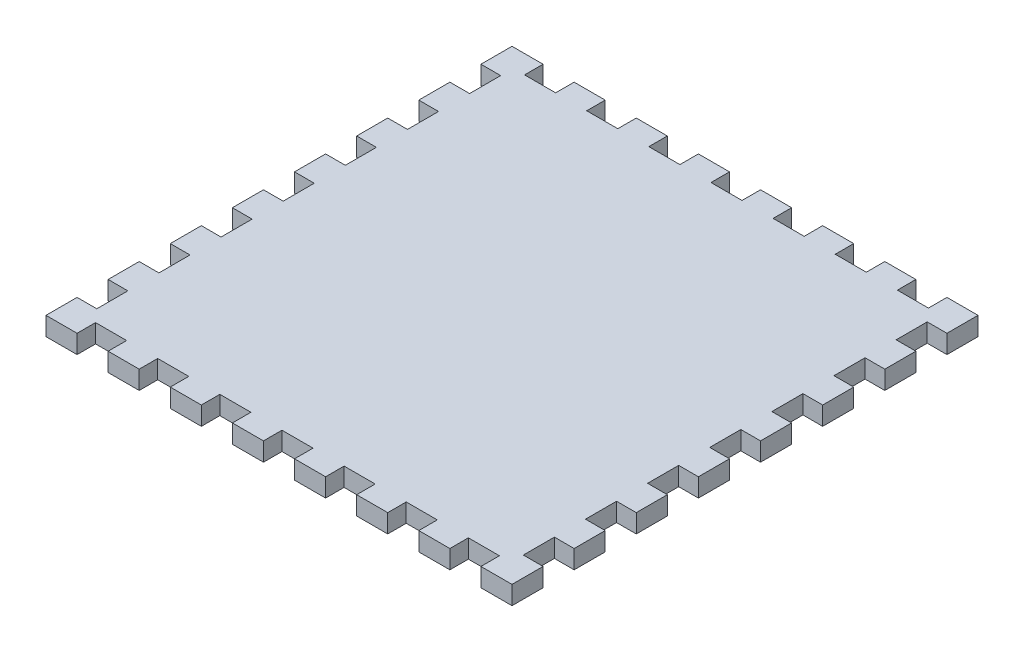
from build123d import *

# Parameters (mm, degrees)
SKETCH1_W           = 80
SKETCH1_H           = 80
BOSS_EXTRUDE1_DEPTH = 3.175
SKETCH3_OUTSIDE_W   = 104.636
SKETCH3_OUTSIDE_H   = 104.636
CUT_EXTRUDE1_DEPTH  = 57.657573413


with BuildPart() as part:
    # Sketch1 → Boss-Extrude1 (new body)
    with BuildSketch(Plane(origin=(0, 0, 0), x_dir=(1, 0, 0), z_dir=(0, 1, 0))):
        Rectangle(SKETCH1_W, SKETCH1_H)
    extrude(amount=BOSS_EXTRUDE1_DEPTH)

    # Sketch3 outside → Cut-Extrude1 (cut, through all)
    with BuildSketch(Plane(origin=(0, 3.175, 0), x_dir=(1, 0, 0), z_dir=(0, 1, 0))):
        Rectangle(SKETCH3_OUTSIDE_W, SKETCH3_OUTSIDE_H)
        Polygon((-40, -40), (-34.666666667, -40), (-34.666666667, -36.825), (-29.333333333, -36.825), (-29.333333333, -40), (-24, -40), (-24, -36.825), (-18.666666667, -36.825), (-18.666666667, -40), (-13.333333333, -40), (-13.333333333, -36.825), (-8, -36.825), (-8, -40), (-2.666666667, -40), (-2.666666667, -36.825), (2.666666667, -36.825), (2.666666667, -40), (8, -40), (8, -36.825), (13.333333333, -36.825), (13.333333333, -40), (18.666666667, -40), (18.666666667, -36.825), (24, -36.825), (24, -40), (29.333333333, -40), (29.333333333, -36.825), (34.666666667, -36.825), (34.666666667, -40), (40, -40), (40, -34.666666667), (36.613333333, -34.666666667), (36.613333333, -29.333333333), (40, -29.333333333), (40, -24), (36.613333333, -24), (36.613333333, -18.666666667), (40, -18.666666667), (40, -13.333333333), (36.613333333, -13.333333333), (36.613333333, -8), (40, -8), (40, -2.666666667), (36.613333333, -2.666666667), (36.613333333, 2.666666667), (40, 2.666666667), (40, 8), (36.613333333, 8), (36.613333333, 13.333333333), (40, 13.333333333), (40, 18.666666667), (36.613333333, 18.666666667), (36.613333333, 24), (40, 24), (40, 29.333333333), (36.613333333, 29.333333333), (36.613333333, 34.666666667), (40, 34.666666667), (40, 40), (34.666666667, 40), (34.666666667, 36.825), (29.333333333, 36.825), (29.333333333, 40), (24, 40), (24, 36.825), (18.666666667, 36.825), (18.666666667, 40), (13.333333333, 40), (13.333333333, 36.825), (8, 36.825), (8, 40), (2.666666667, 40), (2.666666667, 36.825), (-2.666666667, 36.825), (-2.666666667, 40), (-8, 40), (-8, 36.825), (-13.333333333, 36.825), (-13.333333333, 40), (-18.666666667, 40), (-18.666666667, 36.825), (-24, 36.825), (-24, 40), (-29.333333333, 40), (-29.333333333, 36.825), (-34.666666667, 36.825), (-34.666666667, 40), (-40, 40), (-40, 34.666666667), (-36.613333333, 34.666666667), (-36.613333333, 29.333333333), (-40, 29.333333333), (-40, 24), (-36.613333333, 24), (-36.613333333, 18.666666667), (-40, 18.666666667), (-40, 13.333333333), (-36.613333333, 13.333333333), (-36.613333333, 8), (-40, 8), (-40, 2.666666667), (-36.613333333, 2.666666667), (-36.613333333, -2.666666667), (-40, -2.666666667), (-40, -8), (-36.613333333, -8), (-36.613333333, -13.333333333), (-40, -13.333333333), (-40, -18.666666667), (-36.613333333, -18.666666667), (-36.613333333, -24), (-40, -24), (-40, -29.333333333), (-36.613333333, -29.333333333), (-36.613333333, -34.666666667), (-40, -34.666666667), align=None, mode=Mode.SUBTRACT)
    extrude(amount=-CUT_EXTRUDE1_DEPTH, mode=Mode.SUBTRACT)


solid = part.part
